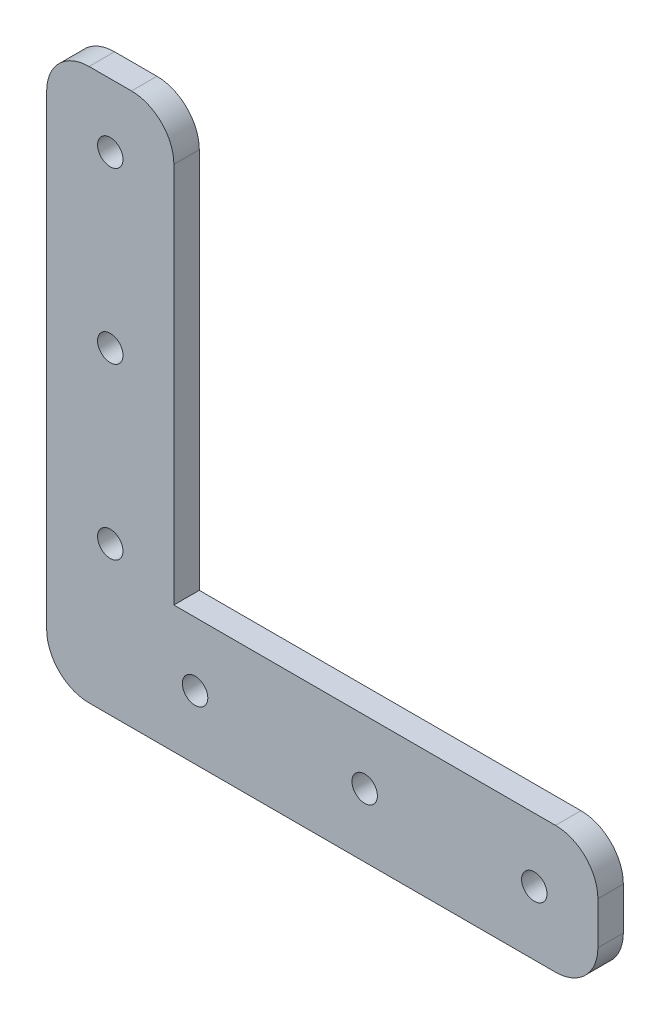
from build123d import *

# Parameters (mm, degrees)
SKETCH_1_R      = 1.5
EXTRUDE_1_DEPTH = 3
FILLET_1_R      = 5


with BuildPart() as part:
    # 草图1 → 凸台-拉伸1 (new body)
    with BuildSketch(Plane.XY):
        Polygon((0, 0), (0, 65), (15, 65), (15, 15), (65, 15), (65, 0), align=None)
        with Locations((7.5, 57.5)):
            Circle(SKETCH_1_R, mode=Mode.SUBTRACT)
        with Locations((7.5, 37.5)):
            Circle(SKETCH_1_R, mode=Mode.SUBTRACT)
        with Locations((7.5, 17.5)):
            Circle(SKETCH_1_R, mode=Mode.SUBTRACT)
        with Locations(Location((57.5, 7.5, 0), (0, 0, 180))):
            Circle(SKETCH_1_R, mode=Mode.SUBTRACT)
        with Locations(Location((37.5, 7.5, 0), (0, 0, 180))):
            Circle(SKETCH_1_R, mode=Mode.SUBTRACT)
        with Locations(Location((17.5, 7.5, 0), (0, 0, 180))):
            Circle(SKETCH_1_R, mode=Mode.SUBTRACT)
    extrude(amount=EXTRUDE_1_DEPTH)

    # 圆角1
    fillet_1_edges = [part.edges().sort_by_distance(p)[0] for p in [
        (0, 0, 1.5),
        (0, 65, 1.5),
        (15, 65, 1.5),
        (65, 15, 1.5),
        (65, 0, 1.5),
    ]]
    fillet(fillet_1_edges, radius=FILLET_1_R)


solid = part.part
